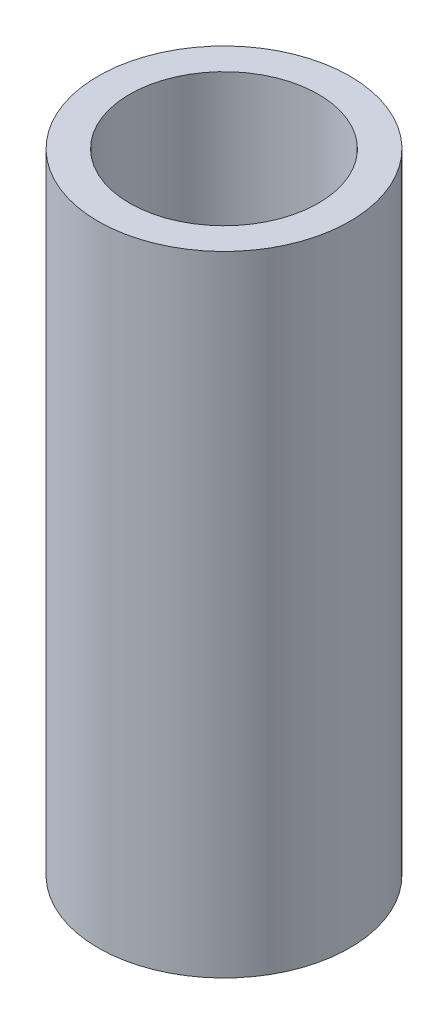
from build123d import *

# Parameters (mm, degrees)
SKETCH1_R           = 4
SKETCH1_R_2         = 3
BOSS_EXTRUDE1_DEPTH = 10


with BuildPart() as part:
    # Sketch1 → Boss-Extrude1 (new, symmetric)
    with BuildSketch(Plane(origin=(0, 0, 0), x_dir=(1, 0, 0), z_dir=(0, 1, 0))):
        with Locations(Location((0, 0, 0), (0, 0, 270))):
            Circle(SKETCH1_R)
        with Locations(Location((0, 0, 0), (0, 0, 270))):
            Circle(SKETCH1_R_2, mode=Mode.SUBTRACT)
    extrude(amount=BOSS_EXTRUDE1_DEPTH, both=True)


solid = part.part
